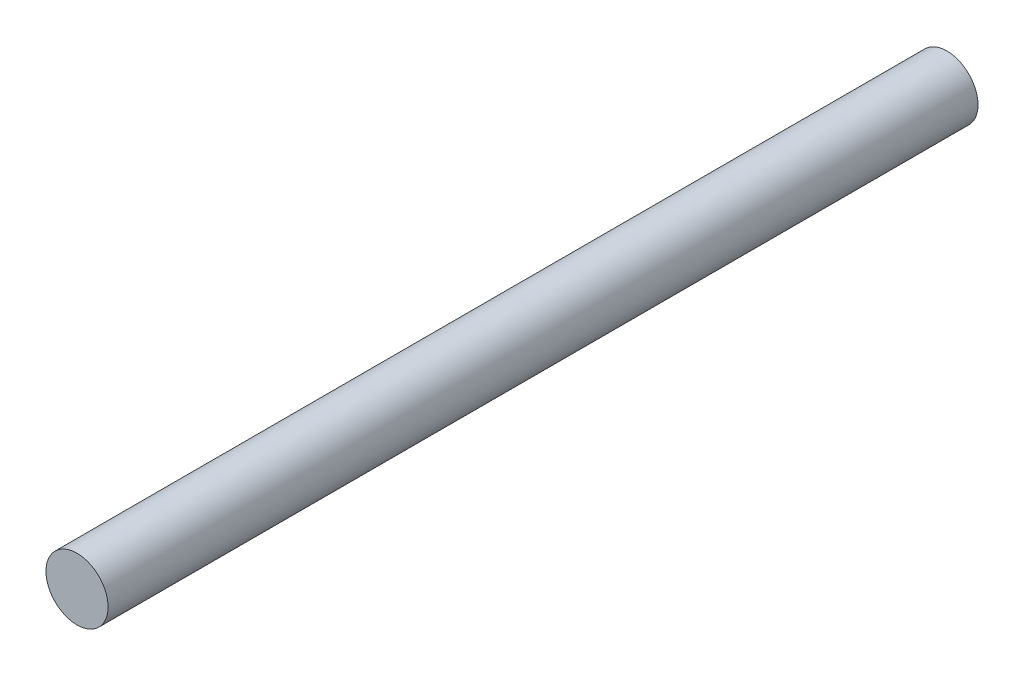
from build123d import *

# Parameters (mm, degrees)
SKETCH1_R           = 0.25
BOSS_EXTRUDE1_DEPTH = 7


with BuildPart() as part:
    # Sketch1 → Boss-Extrude1 (new body)
    with BuildSketch(Plane.XY):
        Circle(SKETCH1_R)
    extrude(amount=BOSS_EXTRUDE1_DEPTH)


solid = part.part
